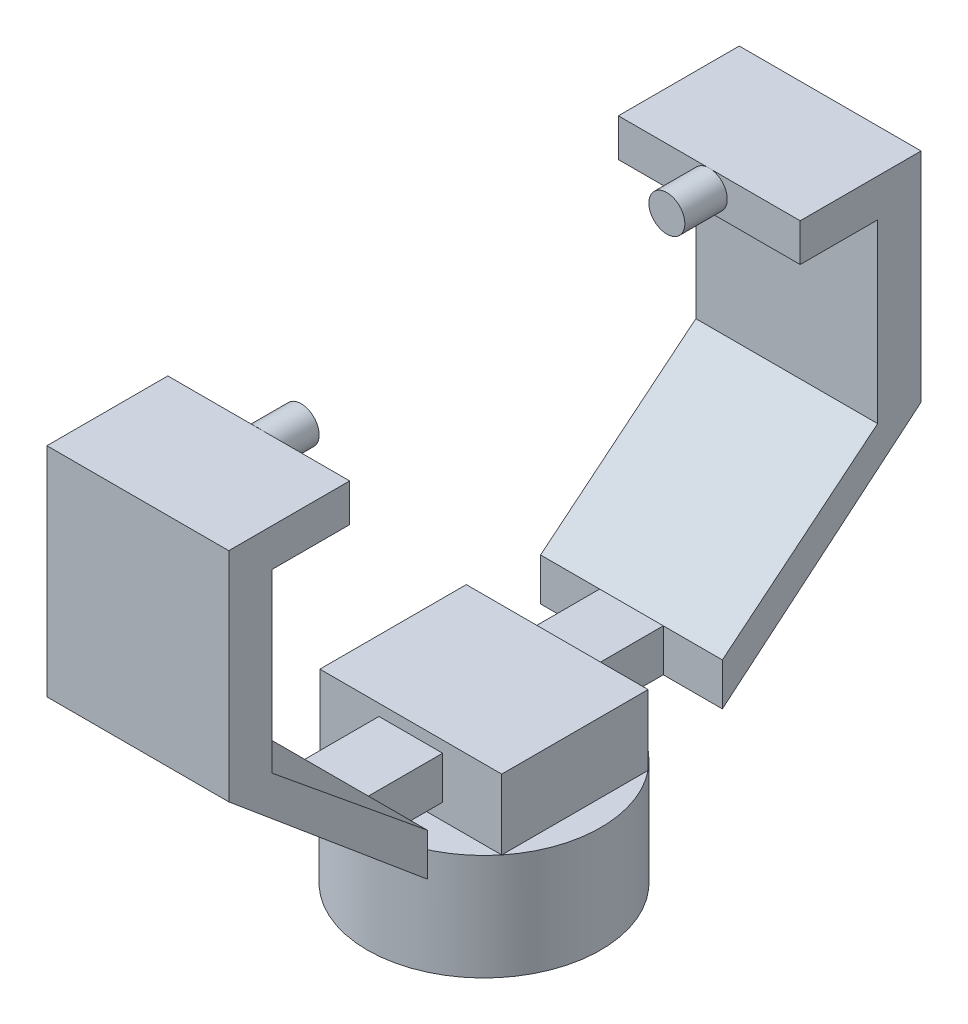
from build123d import *

# Parameters (mm, degrees)
SKETCH1_R                     = 550
BASE_DEPTH                    = 500
SKETCH2_W                     = 856.804380184
SKETCH2_H                     = 689.845094276
ARM_CONNECTION_POINT_DEPTH    = 330
SKETCH3_W                     = 300
SKETCH3_H                     = 200
ARM_BASE_DEPTH                = 350
ARM_REACH                     = 1461.14
SKETCH5_R                     = 84.81932495
ARM_CONNECTION_TO_LIGHT_DEPTH = 200


with BuildPart() as part:
    # Sketch1 → Base (new body)
    with BuildSketch(Plane(origin=(0, 0, 0), x_dir=(1, 0, 0), z_dir=(0, 1, 0))):
        with Locations(Location((0, 0, 0), (0, 0, 270))):
            Circle(SKETCH1_R)
    extrude(amount=BASE_DEPTH)

    # Sketch2 → Arm Connection Point (add)
    with BuildSketch(Plane(origin=(0, 500, 0), x_dir=(1, 0, 0), z_dir=(0, 1, 0))):
        Rectangle(SKETCH2_W, SKETCH2_H)
    extrude(amount=ARM_CONNECTION_POINT_DEPTH)

    # Sketch3 → Arm Base (add)
    with BuildSketch(Plane.XY.offset(344.922547138)):
        with Locations((0, 676.031229805)):
            Rectangle(SKETCH3_W, SKETCH3_H)
    arm_base = extrude(amount=ARM_BASE_DEPTH)

    # Arm: up to this face of the body (flat: up to its plane)
    arm_end = Plane(part.part.faces().sort_by_distance((428.402190092, 665, 0))[0])
    # Sketch4 → Arm (add, up to the picked face)
    with BuildSketch(Plane.ZY.offset(428.402190092), mode=Mode.PRIVATE) as arm_sk1:
        Polygon((694.922547138, 776.031229805), (694.922547138, 576.031229805), (1631.228784508, 1359.819453712), (1631.228784508, 2384.901293654), (1061.596658622, 2384.901293654), (1061.596658622, 2206.156350413), (1426.64220319, 2206.156350413), (1426.64220319, 1374.517361044), align=None)
    arm_tool1 = split(extrude(arm_sk1.sketch, amount=-ARM_REACH, mode=Mode.PRIVATE), bisect_by=arm_end, keep=Keep.BOTH, mode=Mode.PRIVATE)
    arm = arm_tool1.solids().sort_by(Axis((-428.40219, 676.03123, 715.290857), (1, 0, 0)))[0]
    add(arm)

    # Mirror1: Arm Base, Arm across plane
    add(arm_base.mirror(Plane.XY))
    add(arm.mirror(Plane.XY))

    # Sketch5 → Arm Connection to Light (add)
    with BuildSketch(Plane(origin=(0, 0, 1061.596658622), x_dir=(-1, 0, 0), z_dir=(0, 0, -1))):
        with Locations(Location((0, 2300.964058939, 0), (0, 0, 98.270348808))):
            Circle(SKETCH5_R)
    arm_connection_to_light = extrude(amount=ARM_CONNECTION_TO_LIGHT_DEPTH)

    # Mirror2: Arm Connection to Light across plane
    add(arm_connection_to_light.mirror(Plane.XY))


solid = part.part
